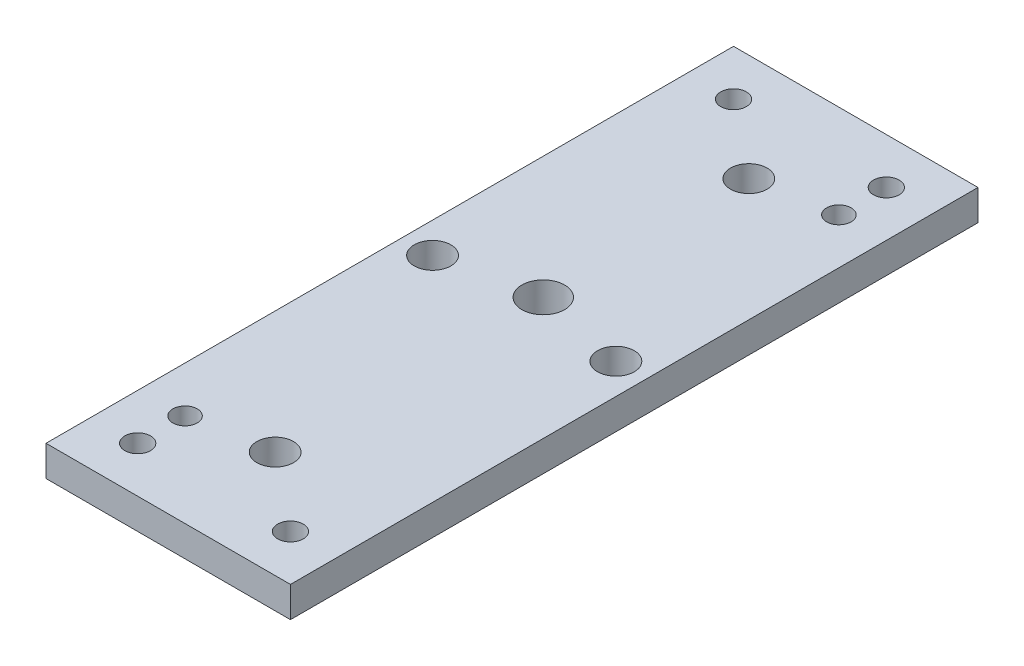
from build123d import *

# Parameters (mm, degrees)
SKETCH1_W             = 80
SKETCH1_H             = 225
BOSS_EXTRUDE1_DEPTH   = 10
CUT_EXTRUDE1_REACH    = 121.818
SKETCH2_R             = 6
M8_CLEARANCE_HOLE1_D  = 8.4
F_8_0MM_DOWEL_HOLE1_D = 8
CUT_EXTRUDE3_REACH    = 121.818
SKETCH10_R            = 7


with BuildPart() as part:
    # Sketch1 → Boss-Extrude1 (new body)
    with BuildSketch(Plane(origin=(0, 0, 0), x_dir=(1, 0, 0), z_dir=(0, 1, 0))):
        Rectangle(SKETCH1_W, SKETCH1_H)
    extrude(amount=-BOSS_EXTRUDE1_DEPTH)

    # Sketch2 → Cut-Extrude1 (cut, up to next)
    with BuildSketch(Plane(origin=(0, 0, 0), x_dir=(1, 0, 0), z_dir=(0, 1, 0)), mode=Mode.PRIVATE) as cut_extrude1_sk1:
        with Locations(Location((0, 77.5, 0), (0, 0, 270))):
            Circle(SKETCH2_R)
    cut_extrude1_tool1 = extrude(cut_extrude1_sk1.sketch, amount=-CUT_EXTRUDE1_REACH, mode=Mode.PRIVATE) & part.part
    # Sketch2 → Cut-Extrude1 (cut, up to next)
    with BuildSketch(Plane(origin=(0, 0, 0), x_dir=(1, 0, 0), z_dir=(0, 1, 0)), mode=Mode.PRIVATE) as cut_extrude1_sk2:
        with Locations(Location((30, 4, 0), (0, 0, 270))):
            Circle(SKETCH2_R)
    cut_extrude1_tool2 = extrude(cut_extrude1_sk2.sketch, amount=-CUT_EXTRUDE1_REACH, mode=Mode.PRIVATE) & part.part
    # Sketch2 → Cut-Extrude1 (cut, up to next)
    with BuildSketch(Plane(origin=(0, 0, 0), x_dir=(1, 0, 0), z_dir=(0, 1, 0)), mode=Mode.PRIVATE) as cut_extrude1_sk3:
        with Locations(Location((-30, 4, 0), (0, 0, 270))):
            Circle(SKETCH2_R)
    cut_extrude1_tool3 = extrude(cut_extrude1_sk3.sketch, amount=-CUT_EXTRUDE1_REACH, mode=Mode.PRIVATE) & part.part
    # Sketch2 → Cut-Extrude1 (cut, up to next)
    with BuildSketch(Plane(origin=(0, 0, 0), x_dir=(1, 0, 0), z_dir=(0, 1, 0)), mode=Mode.PRIVATE) as cut_extrude1_sk4:
        with Locations(Location((0, -77.5, 0), (0, 0, 270))):
            Circle(SKETCH2_R)
    cut_extrude1_tool4 = extrude(cut_extrude1_sk4.sketch, amount=-CUT_EXTRUDE1_REACH, mode=Mode.PRIVATE) & part.part
    add(cut_extrude1_tool1.solids().sort_by_distance((0, 0, -77.5))[0], mode=Mode.SUBTRACT)
    add(cut_extrude1_tool2.solids().sort_by_distance((30, 0, -4))[0], mode=Mode.SUBTRACT)
    add(cut_extrude1_tool3.solids().sort_by_distance((-30, 0, -4))[0], mode=Mode.SUBTRACT)
    add(cut_extrude1_tool4.solids().sort_by_distance((0, 0, 77.5))[0], mode=Mode.SUBTRACT)

    # M8 Clearance Hole1 (through all)
    with Locations(Plane(origin=(0, 0, 0), x_dir=(1, 0, 0), z_dir=(0, 1, 0))):
        with Locations((-25, 97.5), (25, 97.5), (25, -97.5), (-25, -97.5)):
            Hole(M8_CLEARANCE_HOLE1_D / 2)

    # Ø8.0mm Dowel Hole1 (through all)
    with Locations(Plane(origin=(0, 0, 0), x_dir=(1, 0, 0), z_dir=(0, 1, 0))):
        with Locations((25, 81.975), (-25, -82)):
            Hole(F_8_0MM_DOWEL_HOLE1_D / 2)

    # Sketch10 → Cut-Extrude3 (cut, up to next)
    with BuildSketch(Plane(origin=(0, 0, 0), x_dir=(1, 0, 0), z_dir=(0, 1, 0)), mode=Mode.PRIVATE) as cut_extrude3_sk1:
        with Locations(Location((0, 10.23, 0), (0, 0, 270))):
            Circle(SKETCH10_R)
    cut_extrude3_tool1 = extrude(cut_extrude3_sk1.sketch, amount=-CUT_EXTRUDE3_REACH, mode=Mode.PRIVATE) & part.part
    add(cut_extrude3_tool1.solids().sort_by_distance((0, 0, -10.23))[0], mode=Mode.SUBTRACT)


solid = part.part
